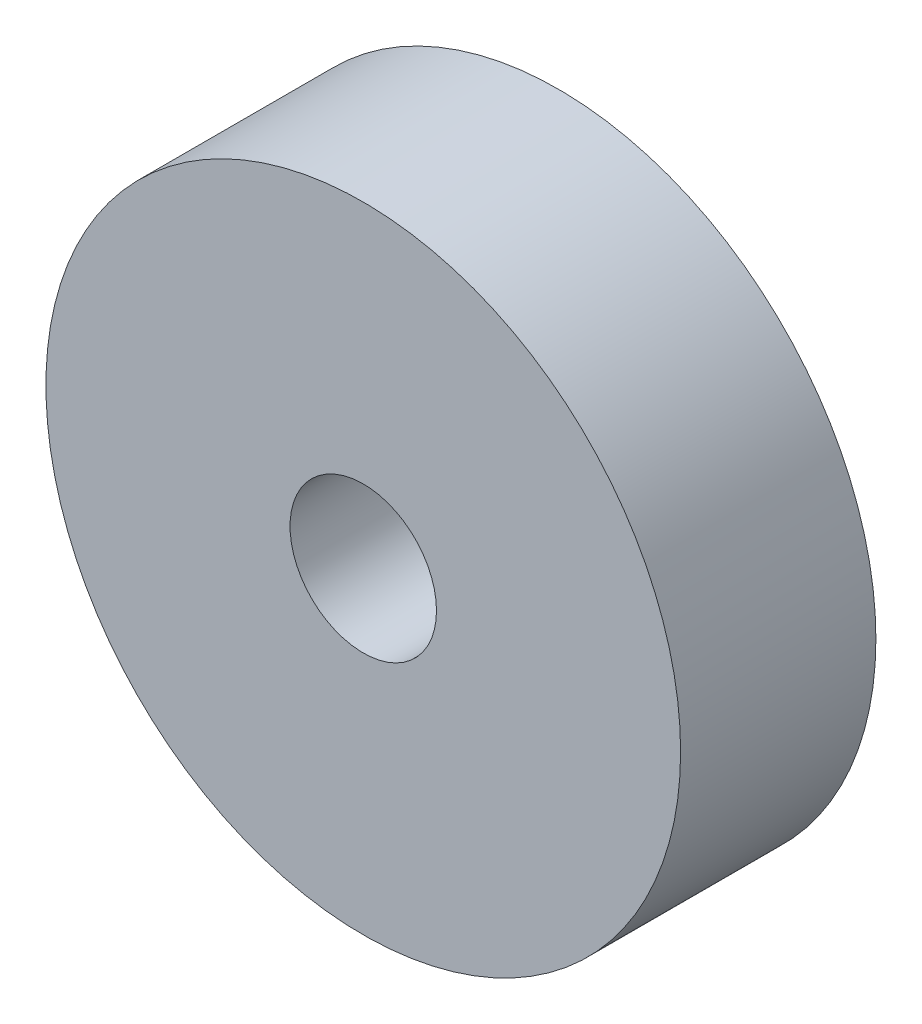
from build123d import *

# Parameters (mm, degrees)
SKETCH_1_R      = 3.25
SKETCH_1_R_2    = 0.75
EXTRUDE_1_DEPTH = 2


with BuildPart() as part:
    # ｽｹｯﾁ1 → ﾎﾞｽ - 押し出し1 (new body)
    with BuildSketch(Plane(origin=(0, 0, 0), x_dir=(0, 1, 0), z_dir=(0, 0, 1))):
        with Locations(Location((0, 0, 0), (0, 0, 270))):
            Circle(SKETCH_1_R)
        with Locations(Location((0, 0, 0), (0, 0, 270))):
            Circle(SKETCH_1_R_2, mode=Mode.SUBTRACT)
    extrude(amount=EXTRUDE_1_DEPTH)


solid = part.part
